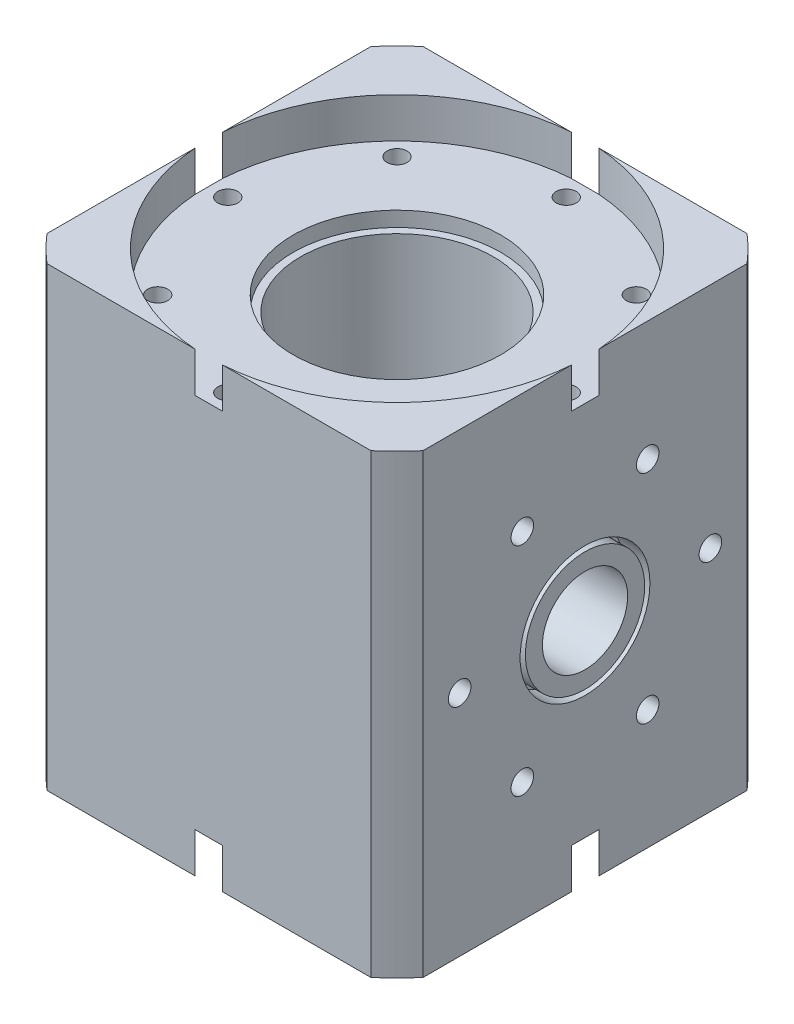
from build123d import *

# Parameters (mm, degrees)
SKETCH1_W                = 75
SKETCH1_H                = 75
BOSS_EXTRUDE1_DEPTH      = 75
SKETCH2_R                = 5.35
CUT_EXTRUDE1_DEPTH       = 92.855865354
SKETCH5_R                = 8.5
CUT_EXTRUDE2_DEPTH       = 113.5
SKETCH7_R                = 20.71
SKETCH7_R_2              = 19.21
CUT_EXTRUDE3_DEPTH       = 3
SKETCH11_R               = 2
CUT_EXTRUDE4_DEPTH       = 10
SKETCH13_R               = 19.21
CUT_EXTRUDE7_DEPTH       = 50
SKETCH19_R               = 12.95
SKETCH19_R_2             = 11.9
CUT_EXTRUDE9_DEPTH       = 5
SKETCH20_R               = 2.25
CUT_EXTRUDE10_DEPTH      = 12.7
BOSS_EXTRUDE2_DEPTH      = 8
CUT_EXTRUDE14_DEPTH      = 99.496192858
CUT_EXTRUDE14_DEPTH_BACK = 99.496192858
SKETCH24_OUTSIDE_W       = 104.95
SKETCH24_OUTSIDE_H       = 104.95
SKETCH24_OUTSIDE_R       = 49.5


with BuildPart() as part:
    # Sketch1 → Boss-Extrude1 (new body)
    with BuildSketch(Plane(origin=(0, 0, 0), x_dir=(1, 0, 0), z_dir=(0, 1, 0))):
        Rectangle(SKETCH1_W, SKETCH1_H)
    extrude(amount=BOSS_EXTRUDE1_DEPTH)

    # Sketch2 → Cut-Extrude1 (cut, through all)
    with BuildSketch(Plane(origin=(0, 0, 0), x_dir=(-1, 0, 0), z_dir=(0, -1, 0))):
        with Locations(Location((0, 0, 0), (0, 0, 90))):
            Circle(SKETCH2_R)
    extrude(amount=-CUT_EXTRUDE1_DEPTH, mode=Mode.SUBTRACT)

    # Sketch5 → Cut-Extrude2 (cut, through all)
    with BuildSketch(Plane(origin=(37.5, 0, 0), x_dir=(0, 0, -1), z_dir=(1, 0, 0))):
        with Locations((0, 37.5)):
            Circle(SKETCH5_R)
    extrude(amount=-CUT_EXTRUDE2_DEPTH, mode=Mode.SUBTRACT)

    # Sketch7 → Cut-Extrude3 (cut)
    with BuildSketch(Plane.XZ):
        with Locations(Location((0, 0, 0), (0, 0, 270))):
            Circle(SKETCH7_R)
        with Locations(Location((0, 0, 0), (0, 0, 270))):
            Circle(SKETCH7_R_2, mode=Mode.SUBTRACT)
    cut_extrude3 = extrude(amount=-CUT_EXTRUDE3_DEPTH, mode=Mode.SUBTRACT)

    # Sketch11 → Cut-Extrude4 (cut)
    with BuildSketch(Plane.XZ):
        with Locations(Location((-33.75, 0, 0), (0, 0, 270))):
            Circle(SKETCH11_R)
        with Locations(Location((-23.864853865, 23.864853865, 0), (0, 0, 270))):
            Circle(SKETCH11_R)
        with Locations(Location((0, 33.75, 0), (0, 0, 270))):
            Circle(SKETCH11_R)
        with Locations(Location((23.864853865, 23.864853865, 0), (0, 0, 270))):
            Circle(SKETCH11_R)
        with Locations(Location((33.75, 0, 0), (0, 0, 270))):
            Circle(SKETCH11_R)
        with Locations(Location((23.864853865, -23.864853865, 0), (0, 0, 270))):
            Circle(SKETCH11_R)
        with Locations(Location((0, -33.75, 0), (0, 0, 270))):
            Circle(SKETCH11_R)
        with Locations(Location((-23.864853865, -23.864853865, 0), (0, 0, 270))):
            Circle(SKETCH11_R)
    cut_extrude4 = extrude(amount=-CUT_EXTRUDE4_DEPTH, mode=Mode.SUBTRACT)

    # Mirror1: Cut-Extrude3, Cut-Extrude4 across plane
    add(cut_extrude3.mirror(Plane.ZX.offset(37.5)), mode=Mode.SUBTRACT)
    add(cut_extrude4.mirror(Plane.ZX.offset(37.5)), mode=Mode.SUBTRACT)

    # Sketch13 → Cut-Extrude7 (cut)
    with BuildSketch(Plane(origin=(0, 75, 0), x_dir=(1, 0, 0), z_dir=(0, 1, 0))):
        with Locations(Location((0, 0, 0), (0, 0, 90))):
            Circle(SKETCH13_R)
    extrude(amount=-CUT_EXTRUDE7_DEPTH, mode=Mode.SUBTRACT)

    # Sketch19 → Cut-Extrude9 (cut)
    with BuildSketch(Plane(origin=(37.5, 0, 0), x_dir=(0, 0, -1), z_dir=(1, 0, 0))):
        with Locations((0, 37.5)):
            Circle(SKETCH19_R)
        with Locations((0, 37.5)):
            Circle(SKETCH19_R_2, mode=Mode.SUBTRACT)
    cut_extrude9 = extrude(amount=-CUT_EXTRUDE9_DEPTH, mode=Mode.SUBTRACT)

    # Sketch20 → Cut-Extrude10 (cut)
    with BuildSketch(Plane(origin=(37.5, 0, 0), x_dir=(0, 0, -1), z_dir=(1, 0, 0))):
        with Locations((-25, 37.5)):
            Circle(SKETCH20_R)
        with Locations((-12.5, 59.150635095)):
            Circle(SKETCH20_R)
        with Locations((12.5, 59.150635095)):
            Circle(SKETCH20_R)
        with Locations((25, 37.5)):
            Circle(SKETCH20_R)
        with Locations((12.5, 15.849364905)):
            Circle(SKETCH20_R)
        with Locations((-12.5, 15.849364905)):
            Circle(SKETCH20_R)
    cut_extrude10 = extrude(amount=-CUT_EXTRUDE10_DEPTH, mode=Mode.SUBTRACT)

    # Mirror4: Cut-Extrude9, Cut-Extrude10 across plane
    add(cut_extrude9.mirror(Plane.ZY), mode=Mode.SUBTRACT)
    add(cut_extrude10.mirror(Plane.ZY), mode=Mode.SUBTRACT)

    # Sketch25 → Boss-Extrude2 (add)
    with BuildSketch(Plane(origin=(0, 0, 0), x_dir=(1, 0, 0), z_dir=(0, 1, 0))):
        with BuildLine():
            Line((-37.5, 37.5), (-37.5, 2.740437921))
            ThreePointArc((-37.5, 2.740437921), (-26.587214973, 26.587214973), (-2.740437921, 37.5))
            Line((-2.740437921, 37.5), (-37.5, 37.5))
        make_face()
        with BuildLine():
            Line((37.5, 37.5), (2.740437921, 37.5))
            ThreePointArc((2.740437921, 37.5), (26.587214973, 26.587214973), (37.5, 2.740437921))
            Line((37.5, 2.740437921), (37.5, 37.5))
        make_face()
        with BuildLine():
            Line((-37.5, -37.5), (-2.740437921, -37.5))
            ThreePointArc((-2.740437921, -37.5), (-26.587214973, -26.587214973), (-37.5, -2.740437921))
            Line((-37.5, -2.740437921), (-37.5, -37.5))
        make_face()
        with BuildLine():
            Line((37.5, -37.5), (37.5, -2.740437921))
            ThreePointArc((37.5, -2.740437921), (26.587214973, -26.587214973), (2.740437921, -37.5))
            Line((2.740437921, -37.5), (37.5, -37.5))
        make_face()
    boss_extrude2 = extrude(amount=-BOSS_EXTRUDE2_DEPTH)

    # Mirror5: Boss-Extrude2 across plane
    add(boss_extrude2.mirror(Plane(origin=(0, 37.5, 0), x_dir=(0, 0, 1), z_dir=(0, -1, 0))))

    # Sketch24 outside → Cut-Extrude14 (cut, two sides: drawn at the far end of the back side and taken through both)
    with BuildSketch(Plane(origin=(0, 0, 0), x_dir=(1, 0, 0), z_dir=(0, 1, 0)).offset(-CUT_EXTRUDE14_DEPTH_BACK)):
        Rectangle(SKETCH24_OUTSIDE_W, SKETCH24_OUTSIDE_H)
        Circle(SKETCH24_OUTSIDE_R, mode=Mode.SUBTRACT)
    extrude(amount=CUT_EXTRUDE14_DEPTH + CUT_EXTRUDE14_DEPTH_BACK, mode=Mode.SUBTRACT)


solid = part.part
